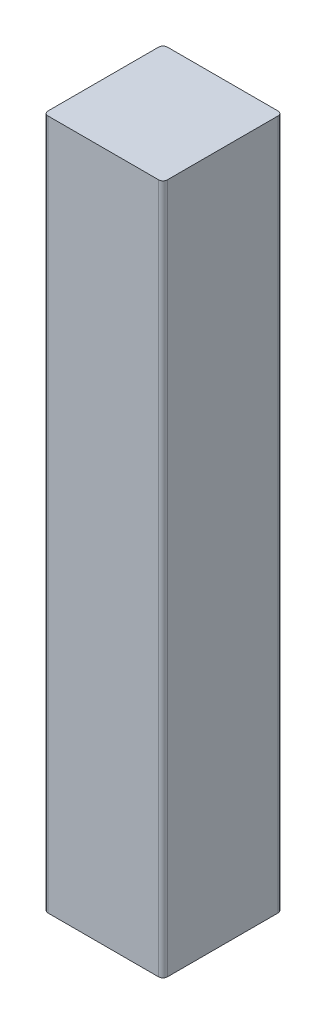
from build123d import *

# Parameters (mm, degrees)
SKETCH1_W           = 88.9
SKETCH1_H           = 514.35
BOSS_EXTRUDE1_DEPTH = 44.45
FILLET1_R           = 3.175


with BuildPart() as part:
    # Sketch1 → Boss-Extrude1 (new, symmetric)
    with BuildSketch(Plane(origin=(0, 0, 0), x_dir=(0, 0, -1), z_dir=(1, 0, 0))):
        with Locations((44.45, 257.175)):
            Rectangle(SKETCH1_W, SKETCH1_H)
    extrude(amount=BOSS_EXTRUDE1_DEPTH, both=True)

    # Fillet1
    fillet1_edges = [part.edges().sort_by_distance(p)[0] for p in [
        (44.45, 257.175, 0),
        (-44.45, 257.175, 0),
        (-44.45, 257.175, -88.9),
        (44.45, 257.175, -88.9),
    ]]
    fillet(fillet1_edges, radius=FILLET1_R)


solid = part.part
